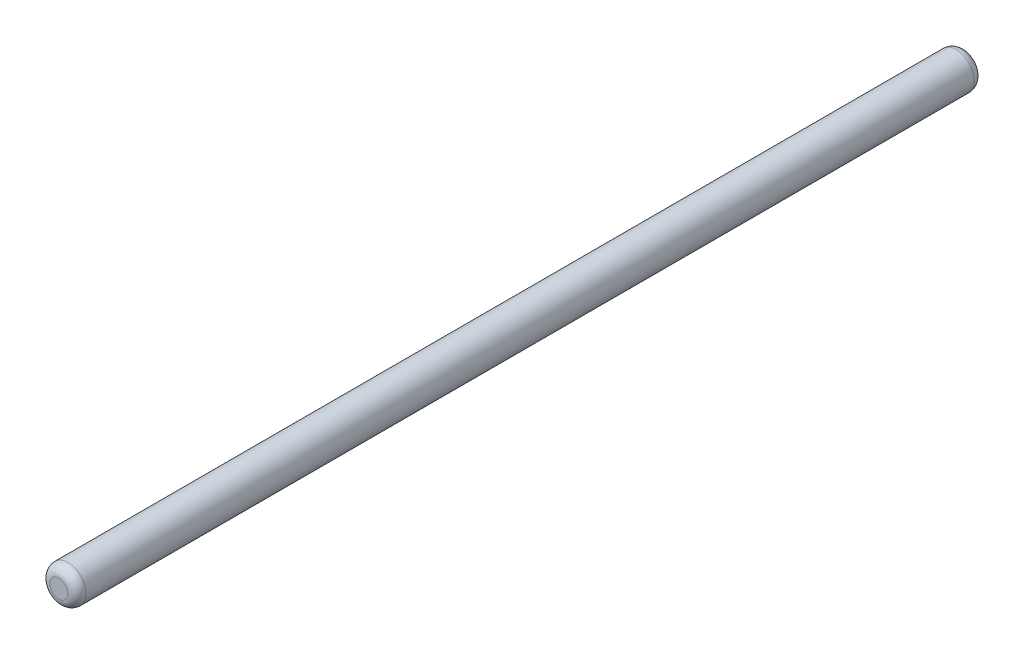
from build123d import *

# Parameters (mm, degrees)
SKETCH1_R           = 10
BOSS_EXTRUDE1_DEPTH = 500
FILLET4_R           = 5
FILLET5_R           = 5


with BuildPart() as part:
    # Sketch1 → Boss-Extrude1 (new body)
    with BuildSketch(Plane.XY):
        Circle(SKETCH1_R)
    extrude(amount=BOSS_EXTRUDE1_DEPTH)

    # Fillet4
    fillet4_edges = [part.edges().sort_by_distance(p)[0] for p in [
        (-10, 0, 500),
    ]]
    fillet(fillet4_edges, radius=FILLET4_R)

    # Fillet5
    fillet5_edges = [part.edges().sort_by_distance(p)[0] for p in [
        (-10, 0, 0),
    ]]
    fillet(fillet5_edges, radius=FILLET5_R)


solid = part.part
